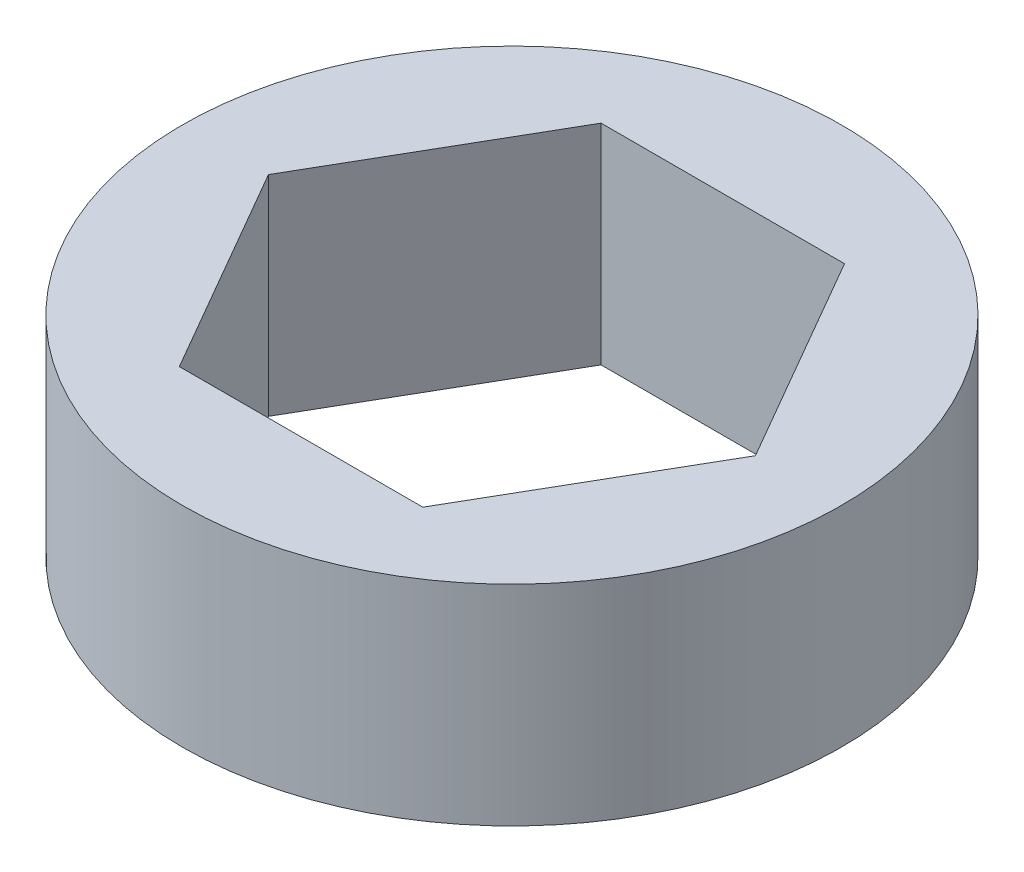
from build123d import *

# Parameters (mm, degrees)
SKETCH1_R           = 9.9949
BOSS_EXTRUDE1_DEPTH = 6.35


with BuildPart() as part:
    # Sketch1 → Boss-Extrude1 (new body)
    with BuildSketch(Plane(origin=(0, 0, 0), x_dir=(1, 0, 0), z_dir=(0, 1, 0))):
        with Locations(Location((0, 0, 0), (0, 0, 270))):
            Circle(SKETCH1_R)
        Polygon((7.383674858, 0), (3.691837429, 6.39445), (-3.691837429, 6.39445), (-7.383674858, 0), (-3.691837429, -6.39445), (3.691837429, -6.39445), align=None, mode=Mode.SUBTRACT)
    extrude(amount=BOSS_EXTRUDE1_DEPTH)


solid = part.part
